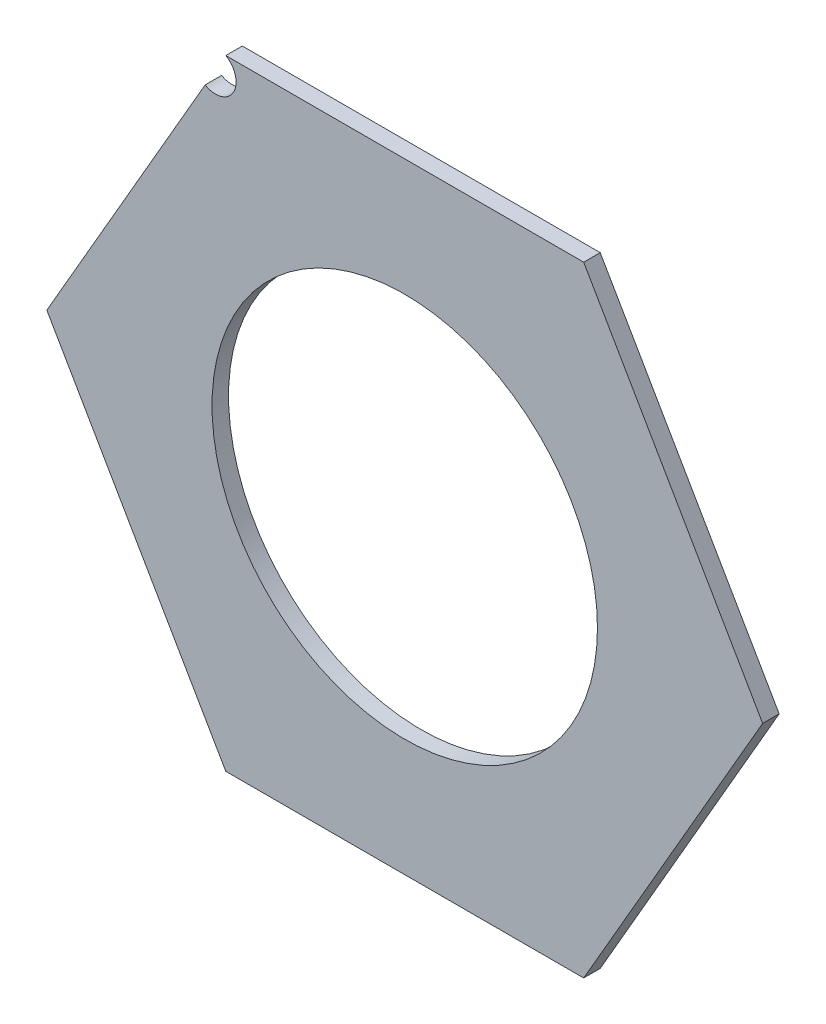
from build123d import *

# Parameters (mm, degrees)
CROQUIS2_R              = 35
SALIENTE_EXTRUIR1_DEPTH = 3


with BuildPart() as part:
    # Croquis2 → Saliente-Extruir1 (new body)
    with BuildSketch(Plane.XY):
        with BuildLine():
            Line((-65, 0), (-32.5, -56.291651246))
            Line((-32.5, -56.291651246), (32.5, -56.291651246))
            Line((32.5, -56.291651246), (65, 0))
            Line((65, 0), (32.5, 56.291651246))
            Line((32.5, 56.291651246), (-32.5, 56.291651246))
            ThreePointArc((-32.5, 56.291651246), (-31.127404736, 51.169055982), (-36.25, 49.796460718))
            Line((-36.25, 49.796460718), (-65, 0))
        make_face()
        Circle(CROQUIS2_R, mode=Mode.SUBTRACT)
    extrude(amount=SALIENTE_EXTRUIR1_DEPTH)


solid = part.part
